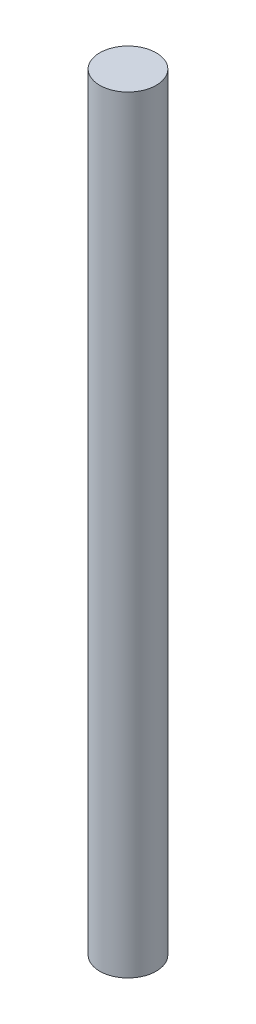
from build123d import *

# Parameters (mm, degrees)
SKETCH1_R           = 2.38125
BOSS_EXTRUDE1_DEPTH = 64.77


with BuildPart() as part:
    # Sketch1 → Boss-Extrude1 (new body)
    with BuildSketch(Plane(origin=(0, 0, 0), x_dir=(1, 0, 0), z_dir=(0, 1, 0))):
        with Locations(Location((0, 0, 0), (0, 0, 270))):
            Circle(SKETCH1_R)
    extrude(amount=BOSS_EXTRUDE1_DEPTH)


solid = part.part
